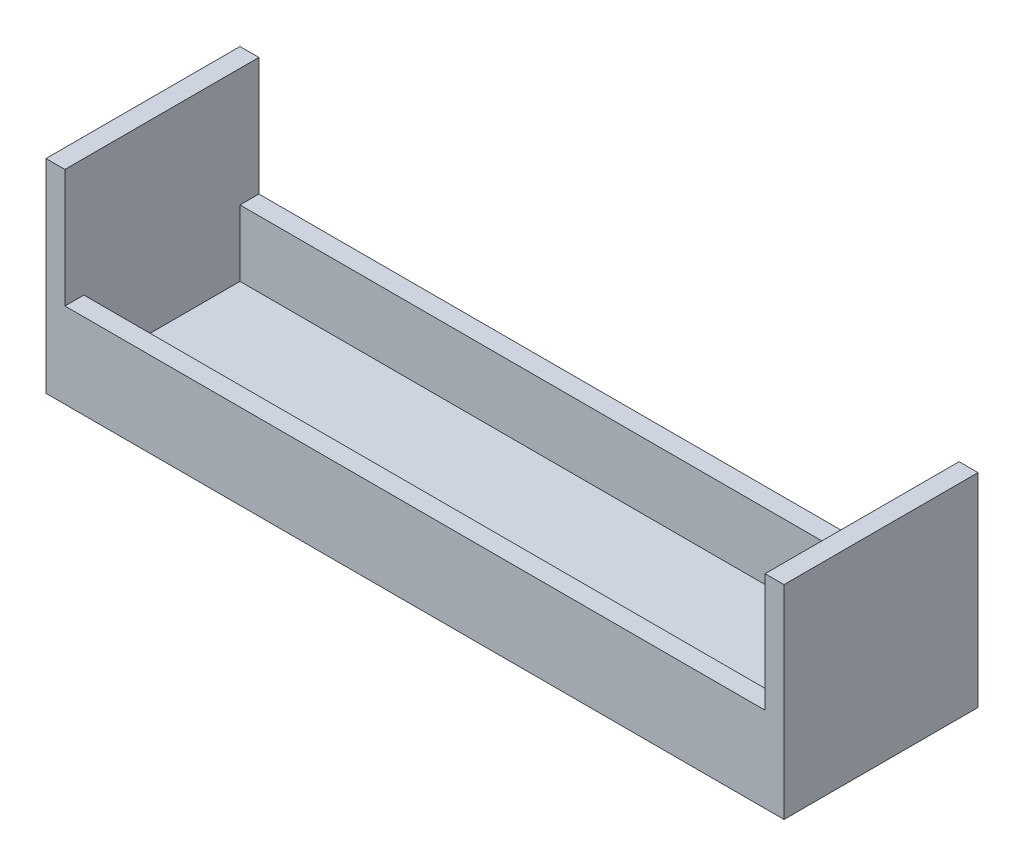
from build123d import *

# Parameters (mm, degrees)
CROQUIS1_W              = 78
CROQUIS1_H              = 20.5
SALIENTE_EXTRUIR1_DEPTH = 21.5
VACIADO1_T              = -2
CROQUIS2_W              = 74
CROQUIS2_H              = 12.5
CORTAR_EXTRUIR1_DEPTH   = 41.5


with BuildPart() as part:
    # Croquis1 → Saliente-Extruir1 (new body)
    with BuildSketch(Plane(origin=(0, 0, 0), x_dir=(1, 0, 0), z_dir=(0, 1, 0))):
        Rectangle(CROQUIS1_W, CROQUIS1_H)
    extrude(amount=SALIENTE_EXTRUIR1_DEPTH)

    # Vaciado1
    vaciado1_openings = [part.faces().sort_by_distance(p)[0] for p in [
        (0, 21.5, 0),
    ]]
    offset(amount=VACIADO1_T, openings=vaciado1_openings, kind=Kind.INTERSECTION)

    # Croquis2 → Cortar-Extruir1 (cut)
    with BuildSketch(Plane.XY.offset(10.25)):
        with Locations((0, 15.25)):
            Rectangle(CROQUIS2_W, CROQUIS2_H)
    extrude(amount=-CORTAR_EXTRUIR1_DEPTH, mode=Mode.SUBTRACT)


solid = part.part
